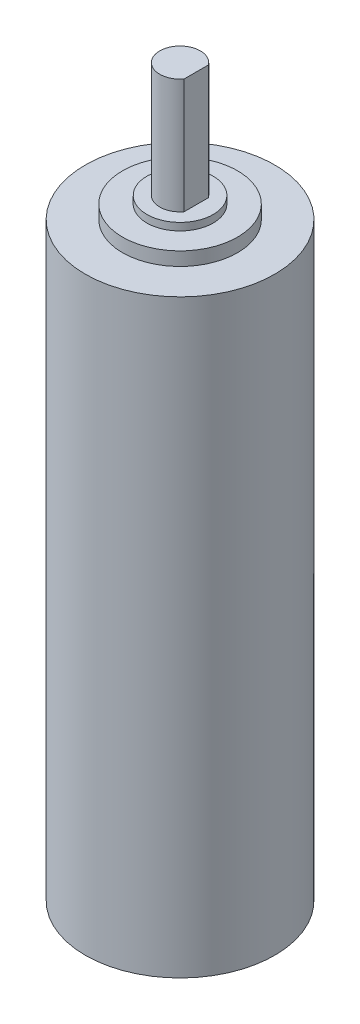
from build123d import *

# Parameters (mm, degrees)
SKETCH_1_R          = 14
SKETCH_2_R          = 14
SKETCH_10_R         = 8.5
SKETCH_5_R          = 8.5
SKETCH_11_R         = 4.9
SKETCH_8_R          = 4.9
SKETCH_9_R          = 3
SKETCH_12_R         = 3
CUT_EXTRUDE_START   = -17
CUT_EXTRUDE_1_DEPTH = 17


with BuildPart() as part:
    # Эскиз1 → По сечениям2 section 0
    with BuildSketch(Plane(origin=(0, 0, 0), x_dir=(1, 0, 0), z_dir=(0, 1, 0))):
        Circle(SKETCH_1_R)
    # Эскиз2 → По сечениям2 section 1
    with BuildSketch(Plane(origin=(0, 87.2, 0), x_dir=(1, 0, 0), z_dir=(0, 1, 0))):
        Circle(SKETCH_2_R)
    loft()

    # Эскиз10 → По сечениям3 section 0
    with BuildSketch(Plane(origin=(0, 87.2, 0), x_dir=(1, 0, 0), z_dir=(0, 1, 0))):
        Circle(SKETCH_10_R)
    # Эскиз5 → По сечениям3 section 1
    with BuildSketch(Plane(origin=(0, 89.2, 0), x_dir=(1, 0, 0), z_dir=(0, 1, 0))):
        Circle(SKETCH_5_R)
    loft()

    # Эскиз11 → По сечениям4 section 0
    with BuildSketch(Plane(origin=(0, 89.2, 0), x_dir=(1, 0, 0), z_dir=(0, 1, 0))):
        Circle(SKETCH_11_R)
    # Эскиз8 → По сечениям4 section 1
    with BuildSketch(Plane(origin=(0, 90.3, 0), x_dir=(1, 0, 0), z_dir=(0, 1, 0))):
        Circle(SKETCH_8_R)
    loft()

    # Эскиз9 → По сечениям5 section 0
    with BuildSketch(Plane(origin=(0, 107.3, 0), x_dir=(1, 0, 0), z_dir=(0, 1, 0))):
        Circle(SKETCH_9_R)
    # Эскиз12 → По сечениям5 section 1
    with BuildSketch(Plane(origin=(0, 90.3, 0), x_dir=(1, 0, 0), z_dir=(0, 1, 0))):
        Circle(SKETCH_12_R)
    loft()

    # Эскиз13 → Вырез-Вытянуть1 (cut)
    with BuildSketch(Plane(origin=(0, 107.3, 0), x_dir=(1, 0, 0), z_dir=(0, 1, 0)).offset(CUT_EXTRUDE_START)):
        with BuildLine():
            Line((2.4, 1.8), (2.4, -1.8))
            ThreePointArc((2.4, -1.8), (2.846049894, -0.948683298), (3, 0))
            ThreePointArc((3, 0), (2.846049894, 0.948683298), (2.4, 1.8))
        make_face()
    extrude(amount=CUT_EXTRUDE_1_DEPTH, mode=Mode.SUBTRACT)


solid = part.part
